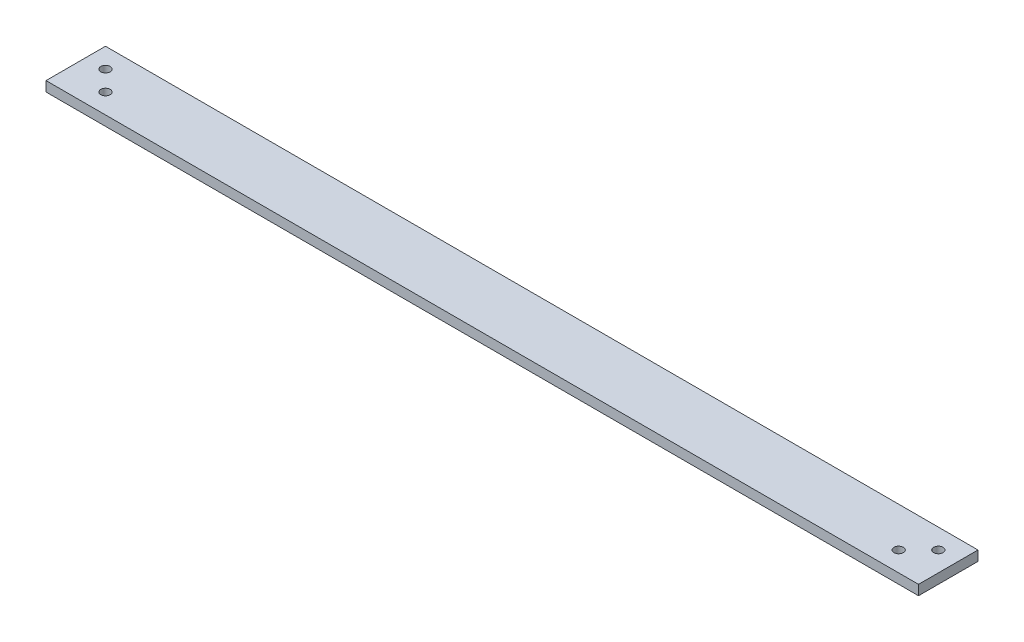
from build123d import *

# Parameters (mm, degrees)
SKETCH1_W           = 279.4
SKETCH1_H           = 19.05
BOSS_EXTRUDE1_DEPTH = 3.175
SKETCH4_R           = 1.5
CUT_EXTRUDE2_DEPTH  = 141.060330751


with BuildPart() as part:
    # Sketch1 → Boss-Extrude1 (new body)
    with BuildSketch(Plane(origin=(0, 0, 0), x_dir=(1, 0, 0), z_dir=(0, 1, 0))):
        Rectangle(SKETCH1_W, SKETCH1_H)
    extrude(amount=BOSS_EXTRUDE1_DEPTH)

    # Sketch4 → Cut-Extrude2 (cut, through all)
    with BuildSketch(Plane(origin=(0, 3.175, 0), x_dir=(1, 0, 0), z_dir=(0, 1, 0))):
        with Locations(Location((-133.35, 3.175, 0), (0, 0, 270))):
            Circle(SKETCH4_R)
        with Locations(Location((-127, -3.175, 0), (0, 0, 270))):
            Circle(SKETCH4_R)
    cut_extrude2 = extrude(amount=-CUT_EXTRUDE2_DEPTH, mode=Mode.SUBTRACT)

    # Mirror1: Cut-Extrude2 across plane
    add(cut_extrude2.mirror(Plane(origin=(0, 0, 0), x_dir=(0, 0, 1), z_dir=(1, 0, 0))), mode=Mode.SUBTRACT)


solid = part.part
